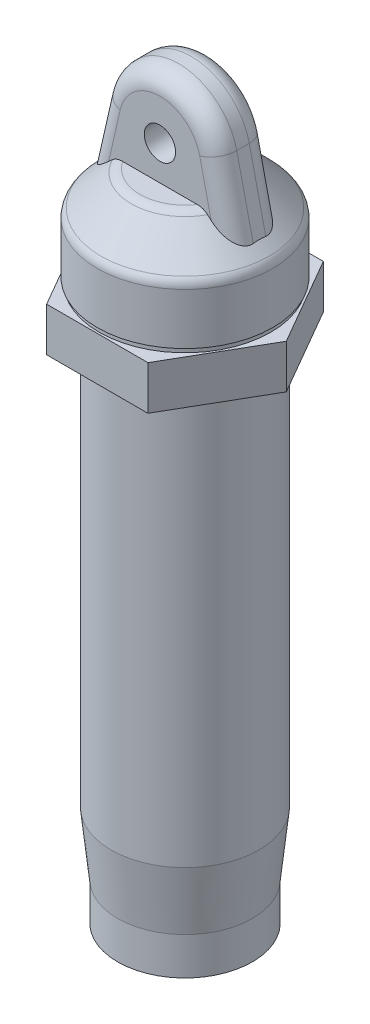
from build123d import *

# Parameters (mm, degrees)
SKETCH1_R                = 5.375
BOSS_EXTRUDE1_DEPTH      = 3
SKETCH2_R                = 5.375
BOSS_EXTRUDE2_DEPTH      = 5
BOSS_EXTRUDE2_DRAFT      = -6
SKETCH3_R                = 5.900521176
BOSS_EXTRUDE3_DEPTH      = 32.75
BOSS_EXTRUDE4_DEPTH      = 3.5
SKETCH6_R                = 6.846847864
BOSS_EXTRUDE5_DEPTH      = 0.396875
SKETCH7_R                = 7
BOSS_EXTRUDE6_DEPTH      = 4.5
SKETCH8_R                = 7
BOSS_EXTRUDE7_DEPTH      = 3
BOSS_EXTRUDE7_TAPER      = 45
BOSS_EXTRUDE8_DEPTH      = 2
BOSS_EXTRUDE8_DEPTH_BACK = 2
SKETCH9_R                = 4.75
SKETCH9_R_2              = 1.25
FILLET1_R                = 1
FILLET2_R                = 1.5
SKETCH10_R               = 1.5
CUT_EXTRUDE1_DEPTH       = 44.25


with BuildPart() as part:
    # Sketch1 → Boss-Extrude1 (new body)
    with BuildSketch(Plane(origin=(0, 0, 0), x_dir=(1, 0, 0), z_dir=(0, 1, 0))):
        with Locations(Location((0, 0, 0), (0, 0, 270))):
            Circle(SKETCH1_R)
    extrude(amount=BOSS_EXTRUDE1_DEPTH)


with BuildPart() as boss_extrude2_tool:
    # Sketch2 → Boss-Extrude2 (with draft: the straight prism first)
    with BuildSketch(Plane(origin=(0, 3, 0), x_dir=(1, 0, 0), z_dir=(0, 1, 0))):
        with Locations(Location((0, 0, 0), (0, 0, 270))):
            Circle(SKETCH2_R)
    extrude(amount=BOSS_EXTRUDE2_DEPTH)
    # Boss-Extrude2: the draft: its side faces are tilted about the plane it starts from
    boss_extrude2_sides = [boss_extrude2_tool.faces().sort_by_distance(p)[0] for p in [
        (0, 5.5, -5.375),
    ]]
    draft(boss_extrude2_sides, Plane(origin=(0, 3, 0), x_dir=(1, 0, 0), z_dir=(0, 1, 0)), BOSS_EXTRUDE2_DRAFT)


with BuildPart() as part_1:
    add(part.part)

    # Boss-Extrude2: add boss_extrude2_tool
    add(boss_extrude2_tool.part)

    # Sketch3 → Boss-Extrude3 (add)
    with BuildSketch(Plane(origin=(0, 8, 0), x_dir=(1, 0, 0), z_dir=(0, 1, 0))):
        with Locations(Location((0, 0, 0), (0, 0, 270))):
            Circle(SKETCH3_R)
    extrude(amount=BOSS_EXTRUDE3_DEPTH)

    # Sketch5 → Boss-Extrude4 (add)
    with BuildSketch(Plane(origin=(0, 40.75, 0), x_dir=(1, 0, 0), z_dir=(0, 1, 0))):
        Polygon((-4.041451884, 7), (-8.082903769, 0), (-4.041451884, -7), (4.041451884, -7), (8.082903769, 0), (4.041451884, 7), align=None)
    extrude(amount=BOSS_EXTRUDE4_DEPTH)

    # Sketch6 → Boss-Extrude5 (add)
    with BuildSketch(Plane(origin=(0, 44.25, 0), x_dir=(1, 0, 0), z_dir=(0, 1, 0))):
        with Locations(Location((0, 0, 0), (0, 0, 270))):
            Circle(SKETCH6_R)
    extrude(amount=BOSS_EXTRUDE5_DEPTH)

    # Sketch7 → Boss-Extrude6 (add)
    with BuildSketch(Plane(origin=(0, 44.646875, 0), x_dir=(1, 0, 0), z_dir=(0, 1, 0))):
        with Locations(Location((0, 0, 0), (0, 0, 270))):
            Circle(SKETCH7_R)
    extrude(amount=BOSS_EXTRUDE6_DEPTH)

    # Sketch8 → Boss-Extrude7 (add)
    with BuildSketch(Plane(origin=(0, 49.146875, 0), x_dir=(1, 0, 0), z_dir=(0, 1, 0))):
        with Locations(Location((0, 0, 0), (0, 0, 270))):
            Circle(SKETCH8_R)
    extrude(amount=BOSS_EXTRUDE7_DEPTH, taper=BOSS_EXTRUDE7_TAPER)

    # Sketch9 → Boss-Extrude8 (add, two sides: drawn at the far end of the back side and taken through both)
    # profile 1 of 2: a face of its own
    with BuildSketch(Plane.XY.offset(-BOSS_EXTRUDE8_DEPTH_BACK)):
        with Locations((0, 54.896875)):
            Circle(SKETCH9_R)
        with Locations((0, 54.896875)):
            Circle(SKETCH9_R_2, mode=Mode.SUBTRACT)
    # profile 2 of 2: a face of its own
    with BuildSketch(Plane.XY.offset(-BOSS_EXTRUDE8_DEPTH_BACK)):
        with BuildLine():
            Line((6.179622496, 49.146875), (4.631634766, 55.950658372))
            ThreePointArc((4.631634766, 55.950658372), (4.72031594, 55.427080084), (4.75, 54.896875))
            ThreePointArc((4.75, 54.896875), (-0.530205084, 50.17655906), (-4.631634766, 55.950658372))
            Line((-4.631634766, 55.950658372), (-6.179622496, 49.146875))
            Line((-6.179622496, 49.146875), (6.179622496, 49.146875))
        make_face()
    extrude(amount=BOSS_EXTRUDE8_DEPTH + BOSS_EXTRUDE8_DEPTH_BACK)

    # Fillet1
    fillet1_edges = [part_1.edges().sort_by_distance(p)[0] for p in [
        (2, 52.146875, 3.464101615),
        (0, 49.146875, -7),
        (0, 52.146875, -4),
    ]]
    fillet(fillet1_edges, radius=FILLET1_R)

    # Fillet2
    fillet2_edges = [part_1.edges().sort_by_distance(p)[0] for p in [
        (-5.332362658, 52.870788493, -2),
        (0, 59.646875, -2),
        (-5.332362658, 52.870788493, 2),
        (0, 59.646875, 2),
        (5.332362658, 52.870788493, -2),
        (5.332362658, 52.870788493, 2),
    ]]
    fillet(fillet2_edges, radius=FILLET2_R)

    # Sketch10 → Cut-Extrude1 (cut)
    with BuildSketch(Plane.XZ):
        with Locations(Location((0, 0, 0), (0, 0, 270))):
            Circle(SKETCH10_R)
    extrude(amount=-CUT_EXTRUDE1_DEPTH, mode=Mode.SUBTRACT)


solid = part_1.part
